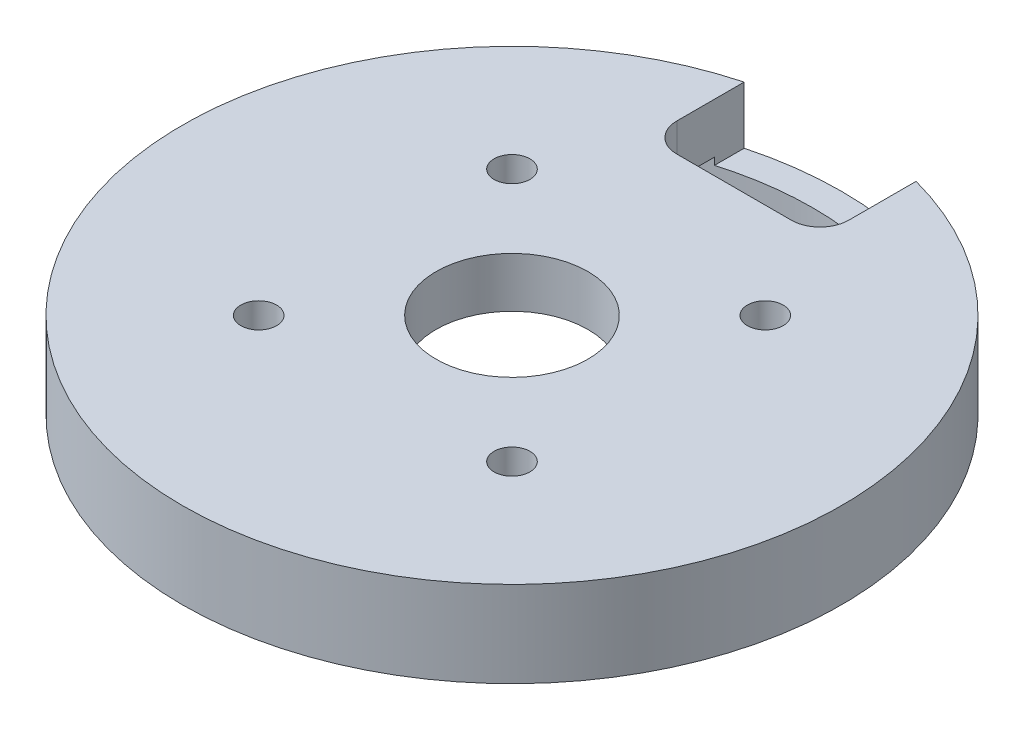
from build123d import *

# Parameters (mm, degrees)
SKETCH_1_R          = 23
EXTRUDE_1_DEPTH     = 6
SKETCH_2_R          = 21
CUT_EXTRUDE_1_DEPTH = 2.5
SKETCH_2_3_R        = 5.3
CUT_EXTRUDE_2_DEPTH = 34.075670817
CUT_EXTRUDE_START   = -4
CUT_EXTRUDE_3_DEPTH = 4
M3X0_51_D           = 2.5


with BuildPart() as part:
    # Эскиз1 → Бобышка-Вытянуть1 (new body)
    with BuildSketch(Plane(origin=(0, 0, 0), x_dir=(1, 0, 0), z_dir=(0, 1, 0))):
        Circle(SKETCH_1_R)
    extrude(amount=EXTRUDE_1_DEPTH)

    # Эскиз2 → Вырез-Вытянуть1 (cut)
    with BuildSketch(Plane.XZ):
        Circle(SKETCH_2_R)
    extrude(amount=-CUT_EXTRUDE_1_DEPTH, mode=Mode.SUBTRACT)

    # Эскиз2<3> → Вырез-Вытянуть2 (cut, through all)
    with BuildSketch(Plane.XZ):
        Circle(SKETCH_2_3_R)
    extrude(amount=-CUT_EXTRUDE_2_DEPTH, mode=Mode.SUBTRACT)

    # Эскиз4 → Вырез-Вытянуть3 (cut)
    with BuildSketch(Plane(origin=(0, 6, 0), x_dir=(1, 0, 0), z_dir=(0, 1, 0)).offset(CUT_EXTRUDE_START)):
        with BuildLine():
            Line((-6, 22.203603311), (-6, 17.5))
            ThreePointArc((-6, 17.5), (-5.414213562, 16.085786438), (-4, 15.5))
            Line((-4, 15.5), (4, 15.5))
            ThreePointArc((4, 15.5), (5.414213562, 16.085786438), (6, 17.5))
            Line((6, 17.5), (6, 22.203603311))
            ThreePointArc((6, 22.203603311), (0, 23), (-6, 22.203603311))
        make_face()
    extrude(amount=CUT_EXTRUDE_3_DEPTH, mode=Mode.SUBTRACT)

    # Отверстие обработанное метчиком M3x0.51 (through all)
    with Locations(Plane(origin=(0, 6, 0), x_dir=(1, 0, 0), z_dir=(0, 1, 0))):
        with Locations((-8.838834765, 8.838834765), (8.838834765, 8.838834765), (8.838834765, -8.838834765), (-8.838834765, -8.838834765)):
            Hole(M3X0_51_D / 2)


solid = part.part
